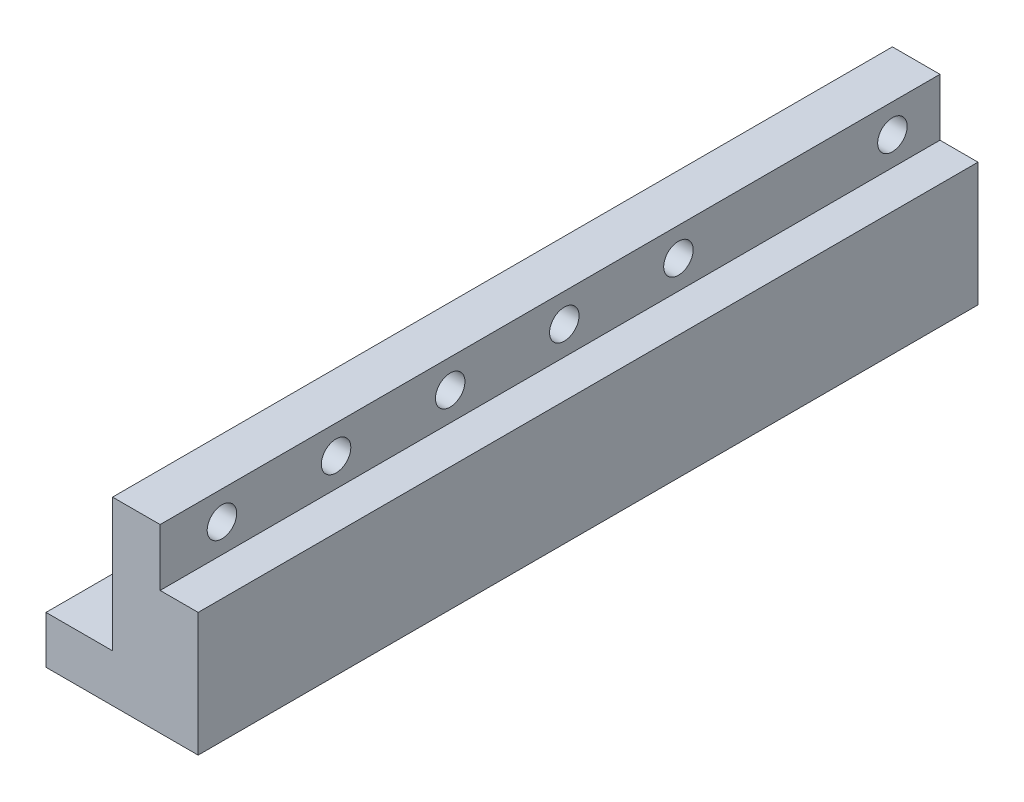
from build123d import *

# Parameters (mm, degrees)
EXTRUDE_1_DEPTH        = 82
SKETCH_2_R             = 1.55
CUT_EXTRUDE_1_DEPTH    = 84.886828525
SKETCH_3_R             = 1.55
CUT_EXTRUDE_2_DEPTH    = 85.711274338
PATTERN_LINEAR_1_COUNT = 5
PATTERN_LINEAR_1_PITCH = 15


with BuildPart() as part:
    # 草圖1 → 填料-伸長1 (new body)
    with BuildSketch(Plane.XY):
        Polygon((-9, 6), (-9, -8), (-16, -8), (-16, -13), (0, -13), (0, 0), (-4, 0), (-4, 6), align=None)
    extrude(amount=EXTRUDE_1_DEPTH)

    # 草圖2 → 除料-伸長1 (cut, through all)
    with BuildSketch(Plane(origin=(-4, 0, 0), x_dir=(0, 0, -1), z_dir=(1, 0, 0))):
        with Locations((-75.5, 3)):
            Circle(SKETCH_2_R)
        with Locations((-63.5, 3)):
            Circle(SKETCH_2_R)
        with Locations((-51.5, 3)):
            Circle(SKETCH_2_R)
        with Locations((-39.5, 3)):
            Circle(SKETCH_2_R)
        with Locations((-27.5, 3)):
            Circle(SKETCH_2_R)
        with Locations((-5, 3)):
            Circle(SKETCH_2_R)
    extrude(amount=-CUT_EXTRUDE_1_DEPTH, mode=Mode.SUBTRACT)

    # 草圖3 → 除料-伸長2 (cut, through all)
    with BuildSketch(Plane(origin=(0, -8, 0), x_dir=(1, 0, 0), z_dir=(0, 1, 0))):
        with Locations(Location((-12.5, -11, 0), (0, 0, 180))):
            Circle(SKETCH_3_R)
    cut_extrude_2 = extrude(amount=-CUT_EXTRUDE_2_DEPTH, mode=Mode.SUBTRACT)

    # 直線複製排列1: 除料-伸長2 ×5
    with Locations(*[(0, 0, i * PATTERN_LINEAR_1_PITCH) for i in range(1, PATTERN_LINEAR_1_COUNT)]):
        add(cut_extrude_2, mode=Mode.SUBTRACT)


solid = part.part
